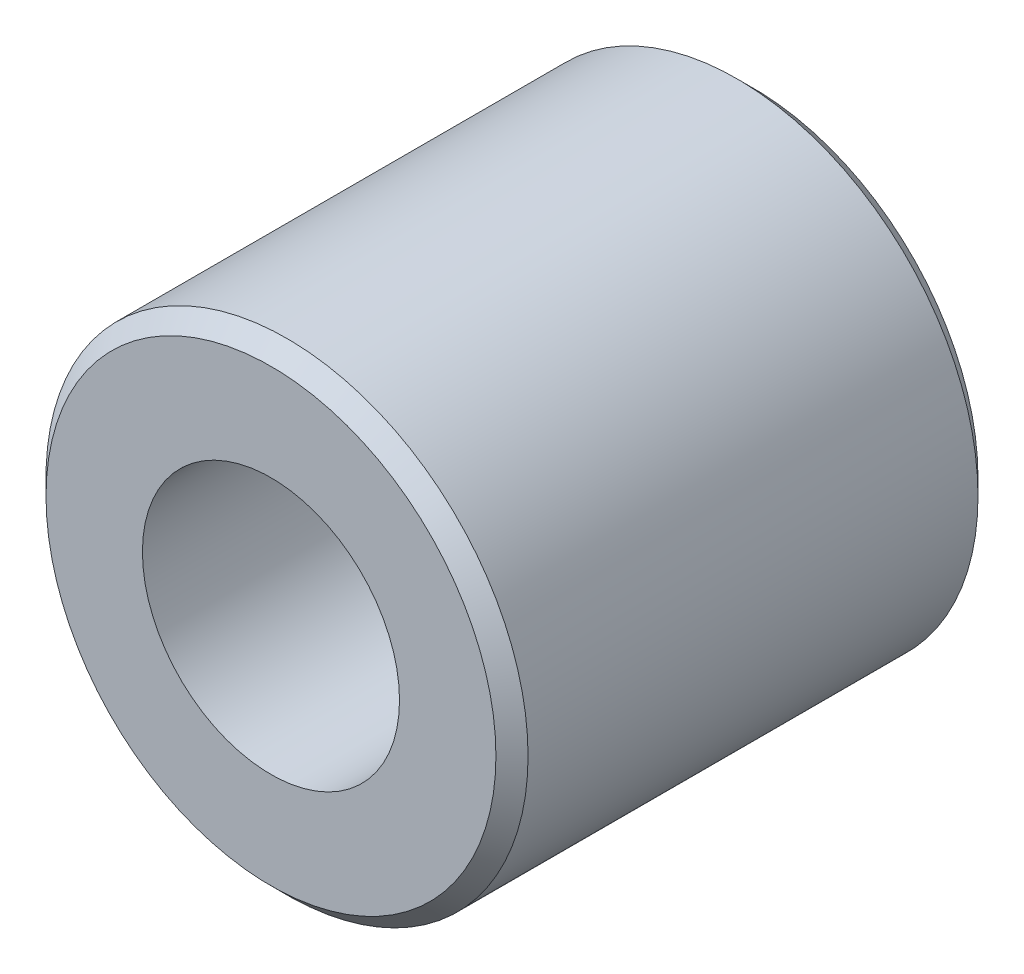
from build123d import *

# Parameters (mm, degrees)
SKETCH_1_R      = 7.5
SKETCH_1_R_2    = 4
EXTRUDE_1_DEPTH = 7.5
CHAMFER_1_SIZE  = 0.5
CHAMFER_2_SIZE  = 0.5


with BuildPart() as part:
    # 草图1 → 凸台-拉伸1 (new, symmetric)
    with BuildSketch(Plane.XY):
        Circle(SKETCH_1_R)
        Circle(SKETCH_1_R_2, mode=Mode.SUBTRACT)
    extrude(amount=EXTRUDE_1_DEPTH, both=True)

    # 倒角1
    chamfer_1_edges = [part.edges().sort_by_distance(p)[0] for p in [
        (-7.5, 0, -7.5),
    ]]
    chamfer(chamfer_1_edges, length=CHAMFER_1_SIZE)

    # 倒角2
    chamfer_2_edges = [part.edges().sort_by_distance(p)[0] for p in [
        (-7.5, 0, 7.5),
    ]]
    chamfer(chamfer_2_edges, length=CHAMFER_2_SIZE)


solid = part.part
